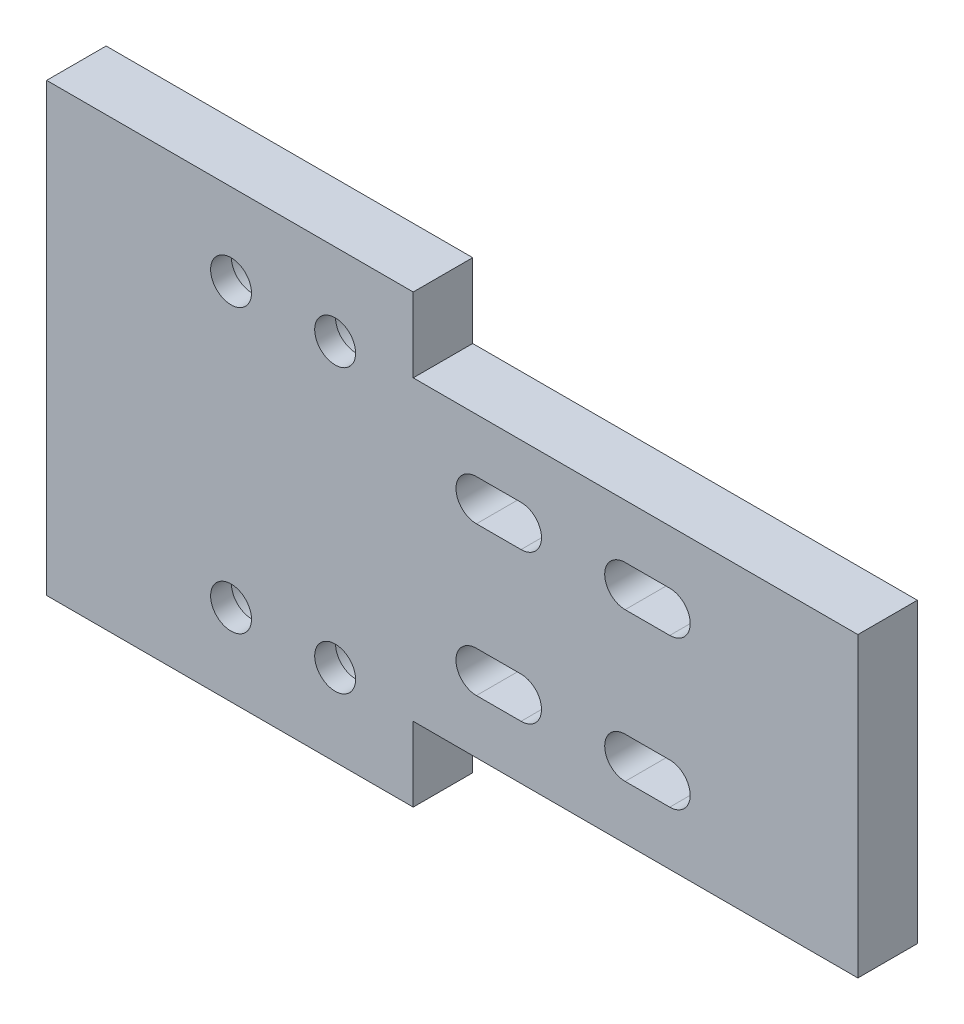
from build123d import *

# Parameters (mm, degrees)
SKETCH1_W           = 109.1
SKETCH1_H           = 40
BOSS_EXTRUDE1_DEPTH = 8
SKETCH2_W           = 49.3
SKETCH2_H           = 10
BOSS_EXTRUDE2_DEPTH = 8
SKETCH3_W           = 49.3
SKETCH3_H           = 10
BOSS_EXTRUDE3_DEPTH = 8
SKETCH4_R           = 2.75
CUT_EXTRUDE1_DEPTH  = 8
SKETCH5_R           = 5
CUT_EXTRUDE2_DEPTH  = 5.2


with BuildPart() as part:
    # Sketch1 → Boss-Extrude1 (new body)
    with BuildSketch(Plane.XY.offset(238)):
        with Locations((281.75, 300)):
            Rectangle(SKETCH1_W, SKETCH1_H)
        with BuildLine():
            Line((285, 287.25), (291, 287.25))
            ThreePointArc((291, 287.25), (293.75, 290), (291, 292.75))
            Line((291, 292.75), (285, 292.75))
            ThreePointArc((285, 292.75), (282.25, 290), (285, 287.25))
        make_face(mode=Mode.SUBTRACT)
        with BuildLine():
            Line((285, 307.25), (291, 307.25))
            ThreePointArc((291, 307.25), (293.75, 310), (291, 312.75))
            Line((291, 312.75), (285, 312.75))
            ThreePointArc((285, 312.75), (282.25, 310), (285, 307.25))
        make_face(mode=Mode.SUBTRACT)
        with BuildLine():
            Line((305, 287.25), (311, 287.25))
            ThreePointArc((311, 287.25), (313.75, 290), (311, 292.75))
            Line((311, 292.75), (305, 292.75))
            ThreePointArc((305, 292.75), (302.25, 290), (305, 287.25))
        make_face(mode=Mode.SUBTRACT)
        with BuildLine():
            Line((305, 307.25), (311, 307.25))
            ThreePointArc((311, 307.25), (313.75, 310), (311, 312.75))
            Line((311, 312.75), (305, 312.75))
            ThreePointArc((305, 312.75), (302.25, 310), (305, 307.25))
        make_face(mode=Mode.SUBTRACT)
    extrude(amount=BOSS_EXTRUDE1_DEPTH)

    # Sketch2 → Boss-Extrude2 (add)
    with BuildSketch(Plane.XY.offset(238)):
        with Locations((251.85, 275)):
            Rectangle(SKETCH2_W, SKETCH2_H)
    extrude(amount=BOSS_EXTRUDE2_DEPTH)

    # Sketch3 → Boss-Extrude3 (add)
    with BuildSketch(Plane.XY.offset(238)):
        with Locations((251.85, 325)):
            Rectangle(SKETCH3_W, SKETCH3_H)
    extrude(amount=BOSS_EXTRUDE3_DEPTH)

    # Sketch4 → Cut-Extrude1 (cut)
    with BuildSketch(Plane.XY.offset(238)):
        with Locations((252, 281)):
            Circle(SKETCH4_R)
        with Locations((252, 319)):
            Circle(SKETCH4_R)
        with Locations((266, 281)):
            Circle(SKETCH4_R)
        with Locations((266, 319)):
            Circle(SKETCH4_R)
    extrude(amount=CUT_EXTRUDE1_DEPTH, mode=Mode.SUBTRACT)

    # Sketch5 → Cut-Extrude2 (cut)
    with BuildSketch(Plane.XY.offset(238)):
        with Locations((252, 281)):
            Circle(SKETCH5_R)
        with Locations((252, 319)):
            Circle(SKETCH5_R)
        with Locations((266, 281)):
            Circle(SKETCH5_R)
        with Locations((266, 319)):
            Circle(SKETCH5_R)
    extrude(amount=CUT_EXTRUDE2_DEPTH, mode=Mode.SUBTRACT)


solid = part.part
